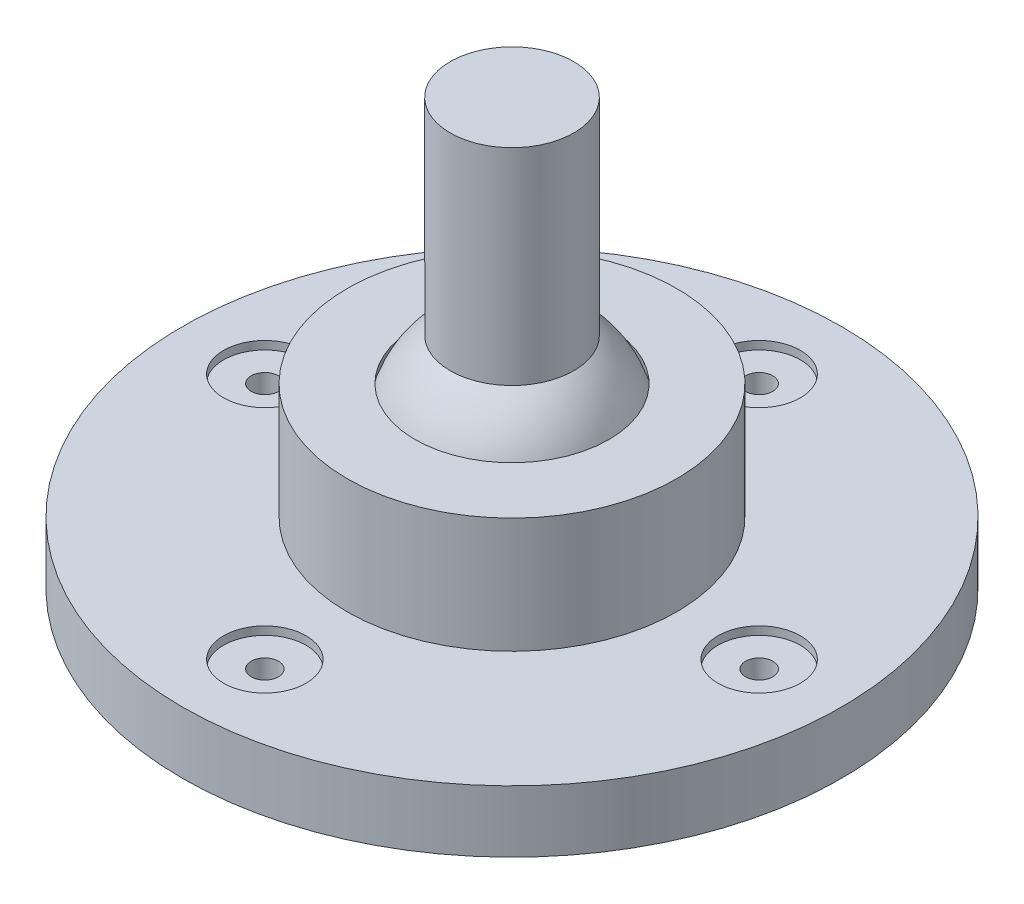
from build123d import *

# Parameters (mm, degrees)
SKETCH2_R               = 10
CUT_EXTRUDE1_DEPTH      = 2
SKETCH3_R               = 3.302
CUT_EXTRUDE2_DEPTH      = 144.449932506
CUT_EXTRUDE3_REACH      = 155.13
CUT_EXTRUDE3_END_RADIUS = 25.5
SKETCH4_R               = 12.5


with BuildPart() as part:
    # Sketch1 → Revolve2 (revolve)
    with BuildSketch(Plane.XY, mode=Mode.PRIVATE) as revolve2_sk:
        with BuildLine():
            Line((0, 70), (15, 70))
            Line((15, 70), (15, 20))
            ThreePointArc((15, 20), (23.717082451, -7.90569415), (0, -25))
            Line((0, -25), (0, 70))
        make_face()
        with BuildLine():
            Line((23.538461538, 9.807692308), (40, 9.807692308))
            Line((40, 9.807692308), (40, -18.192307692))
            Line((40, -18.192307692), (80, -18.192307692))
            Line((80, -18.192307692), (80, -33.192307692))
            Line((80, -33.192307692), (0, -33.192307692))
            Line((0, -33.192307692), (0, -25.5))
            ThreePointArc((0, -25.5), (21.217282506, -14.144855004), (23.538461538, 9.807692308))
        make_face()
    revolve(revolve2_sk.sketch.rotate(Axis((0, 0, 0), (0, -1, 0)), 90), axis=Axis((0, 0, 0), (0, -1, 0)))

    # Sketch2 → Cut-Extrude1 (cut)
    with BuildSketch(Plane(origin=(0, -18.192307692, 0), x_dir=(1, 0, 0), z_dir=(0, 1, 0))):
        with Locations(Location((0, 60, 0), (0, 0, 270))):
            Circle(SKETCH2_R)
        with Locations(Location((60, 0, 0), (0, 0, 270))):
            Circle(SKETCH2_R)
        with Locations(Location((0, -60, 0), (0, 0, 270))):
            Circle(SKETCH2_R)
        with Locations(Location((-60, 0, 0), (0, 0, 270))):
            Circle(SKETCH2_R)
    extrude(amount=-CUT_EXTRUDE1_DEPTH, mode=Mode.SUBTRACT)

    # Sketch3 → Cut-Extrude2 (cut, through all)
    with BuildSketch(Plane(origin=(0, -18.192307692, 0), x_dir=(1, 0, 0), z_dir=(0, 1, 0))):
        with Locations(Location((0, 60, 0), (0, 0, 270))):
            Circle(SKETCH3_R)
        with Locations(Location((60, 0, 0), (0, 0, 270))):
            Circle(SKETCH3_R)
        with Locations(Location((0, -60, 0), (0, 0, 270))):
            Circle(SKETCH3_R)
        with Locations(Location((-60, 0, 0), (0, 0, 270))):
            Circle(SKETCH3_R)
    extrude(amount=-CUT_EXTRUDE2_DEPTH, mode=Mode.SUBTRACT)

    # Cut-Extrude3: up to this sphere (the profile starts outside it)
    cut_extrude3_end = Location((0, 0, 0)) * Sphere(CUT_EXTRUDE3_END_RADIUS, mode=Mode.PRIVATE)
    # Sketch4 → Cut-Extrude3 (cut, up to the surface)
    with BuildSketch(Plane.XZ.offset(33.192307692), mode=Mode.PRIVATE) as cut_extrude3_sk1:
        with Locations(Location((0, 0, 0), (0, 0, 270))):
            Circle(SKETCH4_R)
    cut_extrude3_tool1 = extrude(cut_extrude3_sk1.sketch, amount=-CUT_EXTRUDE3_REACH, mode=Mode.PRIVATE) - cut_extrude3_end
    add(cut_extrude3_tool1.solids().sort_by_distance((0, -33.192308, 0))[0], mode=Mode.SUBTRACT)


solid = part.part
